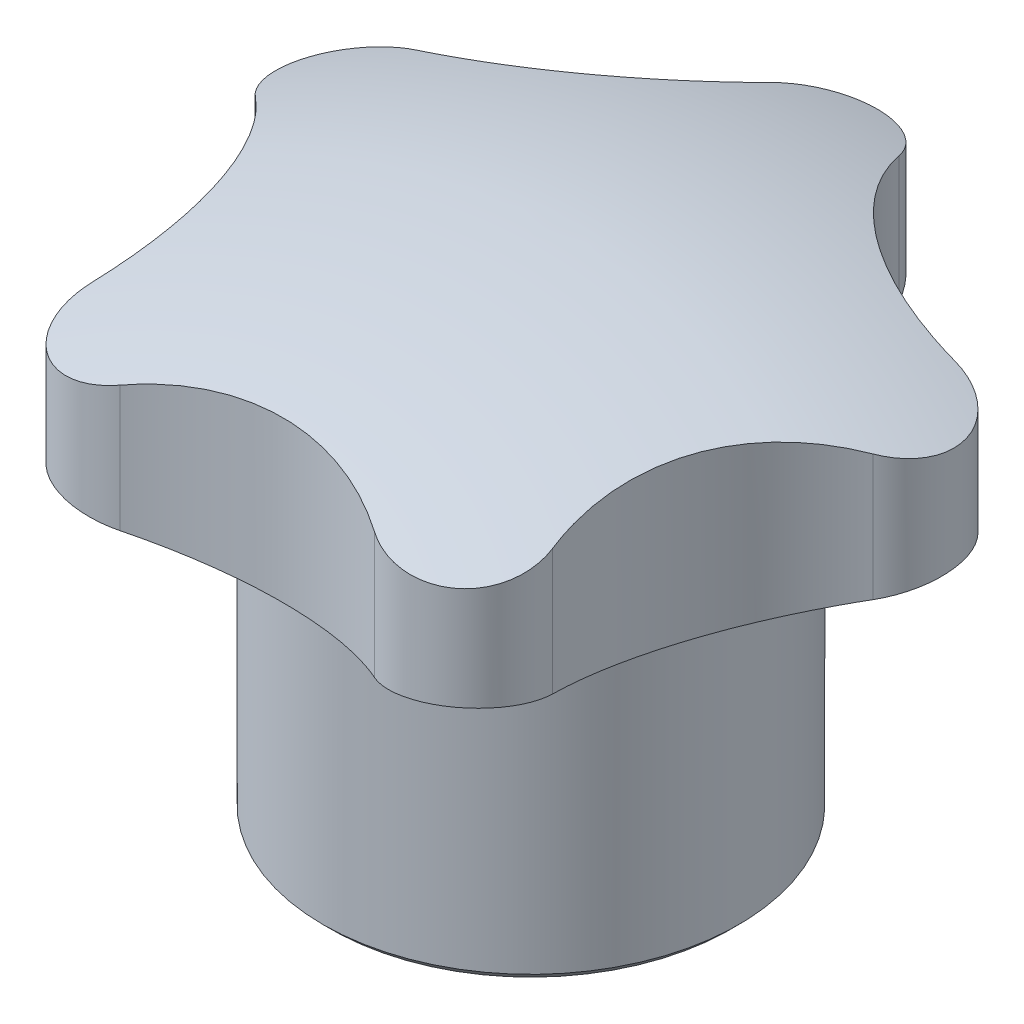
from build123d import *

# Parameters (mm, degrees)
SKETCH_2_R          = 13.5
CUT_EXTRUDE_1_DEPTH = 26.228951623
SKETCH_3_W          = 2.58
SKETCH_3_H          = 12
CHAMFER_1_SIZE      = 0.3


with BuildPart() as part:
    # 草图1 → 旋转1 (revolve)
    with BuildSketch(Plane.XY):
        with BuildLine():
            Line((0, 0), (-7.5, 0))
            Line((-7.5, 0), (-7.5, 10.8))
            ThreePointArc((-7.5, 10.8), (-10.020409182, 11.359397565), (-12.5, 12.078436826))
            Line((-12.5, 12.078436826), (-12.5, 15.795912741))
            ThreePointArc((-12.5, 15.795912741), (-6.346416324, 17.444760518), (0, 18))
            Line((0, 18), (0, 0))
        make_face()
    revolve(axis=Axis((0, 18, 0), (0, -1, 0)))

    # 草图2 → 切除-拉伸1 (cut, through all)
    with BuildSketch(Plane(origin=(0, 0, 0), x_dir=(1, 0, 0), z_dir=(0, 1, 0))):
        Circle(SKETCH_2_R)
        with BuildLine():
            ThreePointArc((2.301292124, 10.976757166), (0, 12.5), (-2.301292124, 10.976757166))
            ThreePointArc((-2.301292124, 10.976757166), (-5.266555861, 7.24879227), (-9.728378055, 5.580663378))
            ThreePointArc((-9.728378055, 5.580663378), (-11.888206454, 3.86271243), (-11.150654806, 1.203345637))
            ThreePointArc((-11.150654806, 1.203345637), (-8.521466386, -2.76879227), (-8.313760417, -7.527717519))
            ThreePointArc((-8.313760417, -7.527717519), (-7.347315654, -10.11271243), (-4.590191543, -10.233048662))
            ThreePointArc((-4.590191543, -10.233048662), (0, -8.96), (4.590191543, -10.233048662))
            ThreePointArc((4.590191543, -10.233048662), (7.347315654, -10.11271243), (8.313760417, -7.527717519))
            ThreePointArc((8.313760417, -7.527717519), (8.521466386, -2.76879227), (11.150654806, 1.203345637))
            ThreePointArc((11.150654806, 1.203345637), (11.888206454, 3.86271243), (9.728378055, 5.580663378))
            ThreePointArc((9.728378055, 5.580663378), (5.266555861, 7.24879227), (2.301292124, 10.976757166))
        make_face(mode=Mode.SUBTRACT)
    extrude(amount=CUT_EXTRUDE_1_DEPTH, mode=Mode.SUBTRACT)

    # 草图3 → 切除-旋转1 (revolve, cut)
    with BuildSketch(Plane.XY, mode=Mode.PRIVATE) as cut_revolve_1_sk:
        with Locations((1.29, 6)):
            Rectangle(SKETCH_3_W, SKETCH_3_H)
    revolve(cut_revolve_1_sk.sketch.rotate(Axis((0, 0, 0), (0, 1, 0)), 173.840646027), axis=Axis((0, 0, 0), (0, 1, 0)), mode=Mode.SUBTRACT)

    # 倒角1
    chamfer_1_edges = [part.edges().sort_by_distance(p)[0] for p in [
        (7.5, 0, 0),
    ]]
    chamfer(chamfer_1_edges, length=CHAMFER_1_SIZE)


solid = part.part
